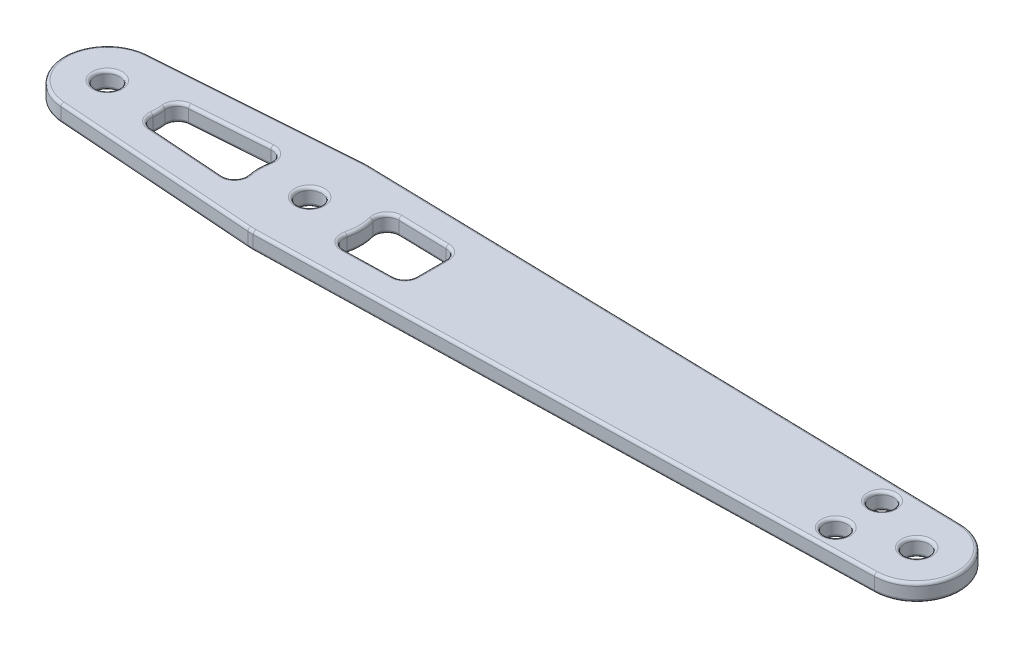
from build123d import *

# Parameters (mm, degrees)
SKETCH1_R           = 2.1
BOSS_EXTRUDE1_DEPTH = 3
CUT_EXTRUDE1_DEPTH  = 6
SKETCH4_R           = 2
CUT_EXTRUDE2_DEPTH  = 148.869029888
FILLET1_R           = 0.5


with BuildPart() as part:
    # Sketch1 → Boss-Extrude1 (new body)
    with BuildSketch(Plane(origin=(0, 0, 0), x_dir=(1, 0, 0), z_dir=(0, 1, 0))):
        with BuildLine():
            Line((-0.535714286, 7.480842881), (34.285714286, 9.974457174))
            ThreePointArc((34.285714286, 9.974457174), (34.761634199, 9.997158684), (35.238095238, 9.997165131))
            Line((35.238095238, 9.997165131), (140.178571429, 7.497873848))
            ThreePointArc((140.178571429, 7.497873848), (147.5, 0), (140.178571429, -7.497873848))
            Line((140.178571429, -7.497873848), (35.238095238, -9.997165131))
            ThreePointArc((35.238095238, -9.997165131), (34.761634199, -9.997158684), (34.285714286, -9.974457174))
            Line((34.285714286, -9.974457174), (-0.535714286, -7.480842881))
            ThreePointArc((-0.535714286, -7.480842881), (-7.5, 0), (-0.535714286, 7.480842881))
        make_face()
        with Locations(Location((0, 0, 0), (0, 0, 270))):
            Circle(SKETCH1_R, mode=Mode.SUBTRACT)
        with Locations(Location((35, 0, 0), (0, 0, 270))):
            Circle(SKETCH1_R, mode=Mode.SUBTRACT)
        with Locations(Location((140, 0, 0), (0, 0, 270))):
            Circle(SKETCH1_R, mode=Mode.SUBTRACT)
    extrude(amount=BOSS_EXTRUDE1_DEPTH)

    # Sketch2 → Cut-Extrude1 (cut)
    with BuildSketch(Plane(origin=(0, 3, 0), x_dir=(1, 0, 0), z_dir=(0, 1, 0))):
        with BuildLine():
            Line((24.086883885, 4.231299641), (10.781990992, 3.278516471))
            ThreePointArc((10.781990992, 3.278516471), (9.383851256, 2.558508804), (8.93851211, 1.050238666))
            ThreePointArc((8.93851211, 1.050238666), (9, 0), (8.93851211, -1.050238666))
            ThreePointArc((8.93851211, -1.050238666), (9.383851256, -2.558508804), (10.781990992, -3.278516471))
            Line((10.781990992, -3.278516471), (24.086883885, -4.231299641))
            ThreePointArc((24.086883885, -4.231299641), (25.734967774, -3.55333358), (26.187969932, -1.829788532))
            ThreePointArc((26.187969932, -1.829788532), (26, 0), (26.187969932, 1.829788532))
            ThreePointArc((26.187969932, 1.829788532), (25.734967774, 3.55333358), (24.086883885, 4.231299641))
        make_face()
        with BuildLine():
            Line((45.69905272, -4.74660625), (54.047619048, -4.547774495))
            ThreePointArc((54.047619048, -4.547774495), (55.4309504, -3.945617731), (56, -2.548341469))
            Line((56, -2.548341469), (56, 2.548341469))
            ThreePointArc((56, 2.548341469), (55.4309504, 3.945617731), (54.047619048, 4.547774495))
            Line((54.047619048, 4.547774495), (45.69905272, 4.74660625))
            ThreePointArc((45.69905272, 4.74660625), (44.085153257, 3.990863563), (43.714809368, 2.247687183))
            ThreePointArc((43.714809368, 2.247687183), (44, 0), (43.714809368, -2.247687183))
            ThreePointArc((43.714809368, -2.247687183), (44.085153257, -3.990863563), (45.69905272, -4.74660625))
        make_face()
    extrude(amount=-CUT_EXTRUDE1_DEPTH, mode=Mode.SUBTRACT)

    # Sketch4 → Cut-Extrude2 (cut, through all)
    with BuildSketch(Plane(origin=(0, 3, 0), x_dir=(1, 0, 0), z_dir=(0, 1, 0))):
        with Locations(Location((130, 4, 0), (0, 0, 270))):
            Circle(SKETCH4_R)
        with Locations(Location((130, -4, 0), (0, 0, 90))):
            Circle(SKETCH4_R)
    extrude(amount=-CUT_EXTRUDE2_DEPTH, mode=Mode.SUBTRACT)

    # Fillet1
    fillet1_edges = [part.edges().sort_by_distance(p)[0] for p in [
        (147.5, 3, 0),
        (87.708333333, 0, 8.74751949),
        (34.761634199, 0, 9.997158684),
        (130, 0, -6),
        (130, 3, -6),
        (130, 0, 6),
        (130, 3, 6),
        (87.708333333, 3, -8.74751949),
        (34.761634199, 3, -9.997158684),
        (16.875, 3, -8.727650027),
        (0, 0, -2.1),
        (0, 3, -2.1),
        (-7.5, 3, 0),
        (35, 0, -2.1),
        (35, 3, -2.1),
        (16.875, 3, 8.727650027),
        (140, 0, -2.1),
        (140, 3, -2.1),
        (49.873335884, 0, -4.647190373),
        (44.085153257, 0, -3.990863563),
        (44, 0, 0),
        (44.085153257, 0, 3.990863563),
        (49.873335884, 0, 4.647190373),
        (34.761634199, 3, 9.997158684),
        (55.4309504, 0, 3.945617731),
        (56, 0, 0),
        (55.4309504, 0, -3.945617731),
        (55.4309504, 3, -3.945617731),
        (49.873335884, 3, -4.647190373),
        (44.085153257, 3, -3.990863563),
        (44, 3, 0),
        (44.085153257, 3, 3.990863563),
        (49.873335884, 3, 4.647190373),
        (55.4309504, 3, 3.945617731),
        (56, 3, 0),
        (17.434437438, 0, 3.754908056),
        (25.734967774, 0, 3.55333358),
        (26, 0, 0),
        (25.734967774, 0, -3.55333358),
        (87.708333333, 3, 8.74751949),
        (17.434437438, 0, -3.754908056),
        (9.383851256, 0, -2.558508804),
        (9, 0, 0),
        (9.383851256, 0, 2.558508804),
        (16.875, 0, 8.727650027),
        (9.383851256, 3, 2.558508804),
        (17.434437438, 3, 3.754908056),
        (-7.5, 0, 0),
        (25.734967774, 3, 3.55333358),
        (26, 3, 0),
        (25.734967774, 3, -3.55333358),
        (17.434437438, 3, -3.754908056),
        (9.383851256, 3, -2.558508804),
        (9, 3, 0),
        (16.875, 0, -8.727650027),
        (34.761634199, 0, -9.997158684),
        (87.708333333, 0, -8.74751949),
        (147.5, 0, 0),
    ]]
    fillet(fillet1_edges, radius=FILLET1_R)


solid = part.part
